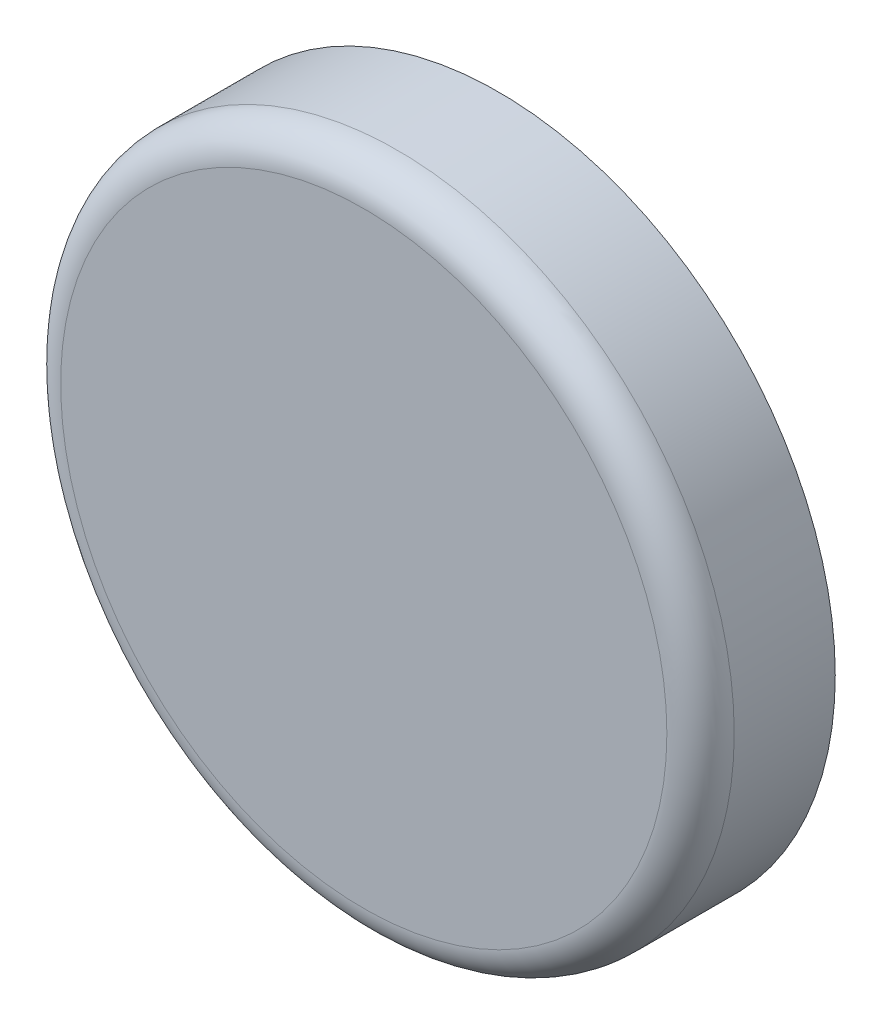
from build123d import *

# Parameters (mm, degrees)
SKETCH3_R           = 5
BOSS_EXTRUDE1_DEPTH = 2
FILLET1_R           = 0.5


with BuildPart() as part:
    # Sketch3 → Boss-Extrude1 (new body)
    with BuildSketch(Plane.XY):
        Circle(SKETCH3_R)
    extrude(amount=BOSS_EXTRUDE1_DEPTH)

    # Fillet1
    fillet1_edges = [part.edges().sort_by_distance(p)[0] for p in [
        (-5, 0, 2),
    ]]
    fillet(fillet1_edges, radius=FILLET1_R)


solid = part.part
